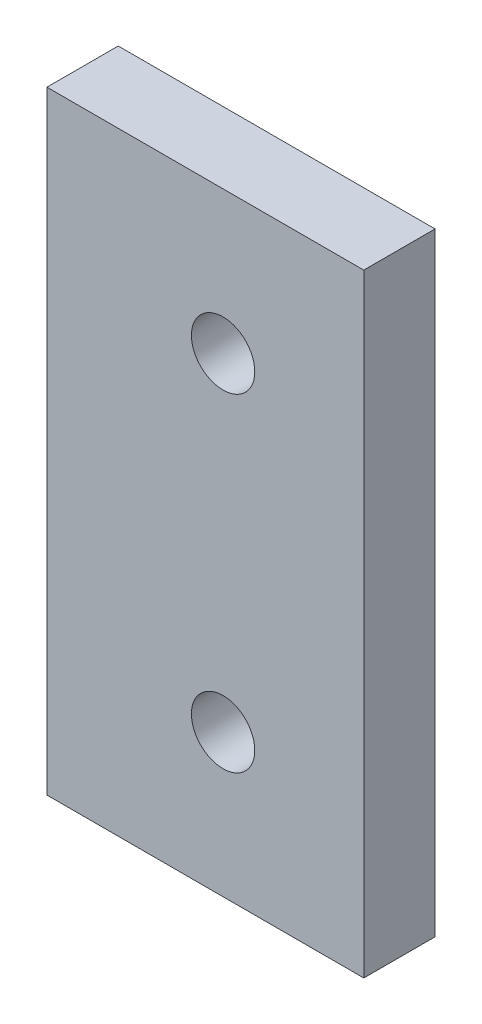
from build123d import *

# Parameters (mm, degrees)
SKETCH1_W           = 20
SKETCH1_H           = 38.7
SKETCH1_R           = 2
BOSS_EXTRUDE1_DEPTH = 4.5


with BuildPart() as part:
    # Sketch1 → Boss-Extrude1 (new body)
    with BuildSketch(Plane.XY):
        with Locations((-1.1183, 10.35)):
            Rectangle(SKETCH1_W, SKETCH1_H)
        Circle(SKETCH1_R, mode=Mode.SUBTRACT)
        with Locations((0, 20.7)):
            Circle(SKETCH1_R, mode=Mode.SUBTRACT)
    extrude(amount=BOSS_EXTRUDE1_DEPTH)


solid = part.part
